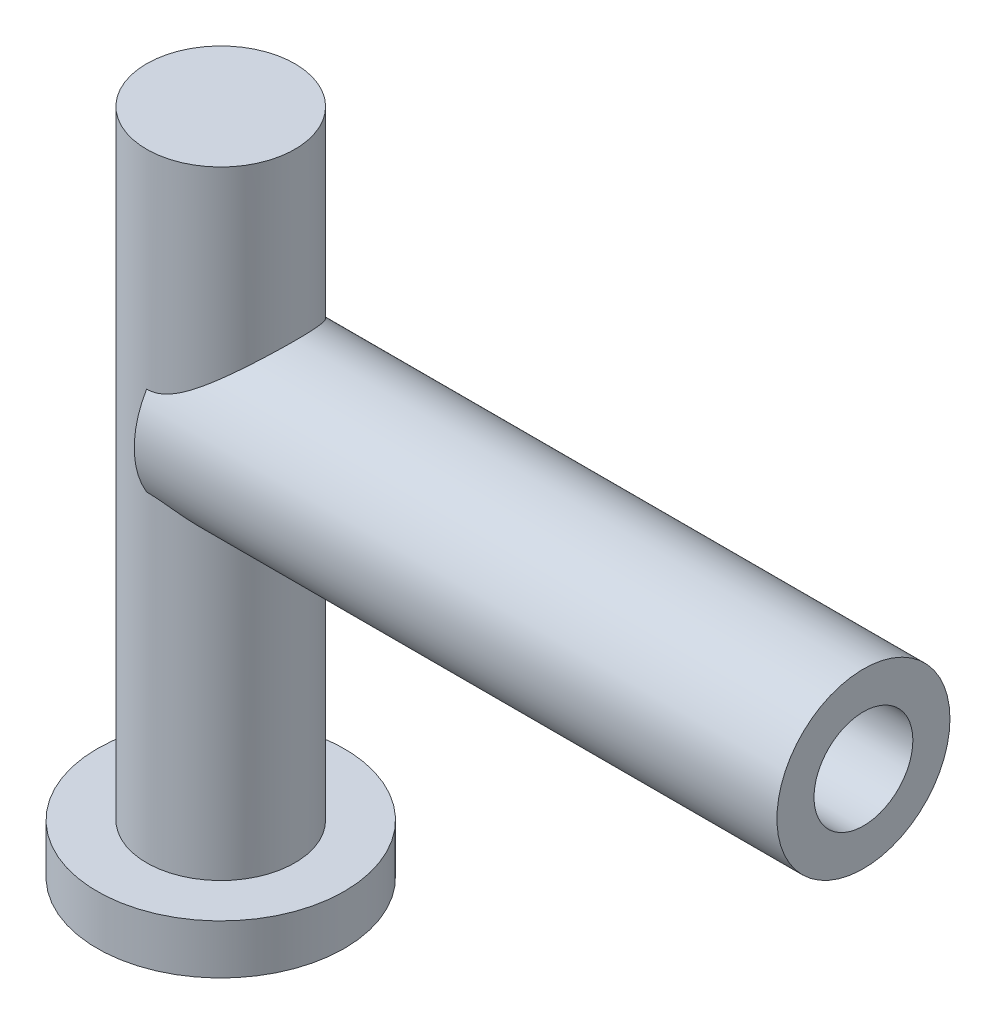
from build123d import *

# Parameters (mm, degrees)
SKETCH2_R           = 35
BOSS_EXTRUDE1_DEPTH = 260
SKETCH3_R           = 20
CUT_EXTRUDE1_DEPTH  = 342.796723254


with BuildPart() as part:
    # Sketch1 → Revolve1 (revolve)
    with BuildSketch(Plane.XY):
        Polygon((0, 135), (0, -135), (50, -135), (50, -115), (30, -115), (30, 135), align=None)
    revolve(axis=Axis((0, 135, 0), (0, -1, 0)))

    # Sketch2 → Boss-Extrude1 (add)
    with BuildSketch(Plane(origin=(0, 0, 0), x_dir=(0, 0, 1), z_dir=(1, 0, 0))):
        with Locations((0, -32.949046657)):
            Circle(SKETCH2_R)
    extrude(amount=BOSS_EXTRUDE1_DEPTH)

    # Sketch3 → Cut-Extrude1 (cut, through all)
    with BuildSketch(Plane(origin=(260, 0, 0), x_dir=(0, 0, -1), z_dir=(1, 0, 0))):
        with Locations((0, 32.949046657)):
            Circle(SKETCH3_R)
    extrude(amount=-CUT_EXTRUDE1_DEPTH, mode=Mode.SUBTRACT)


solid = part.part
